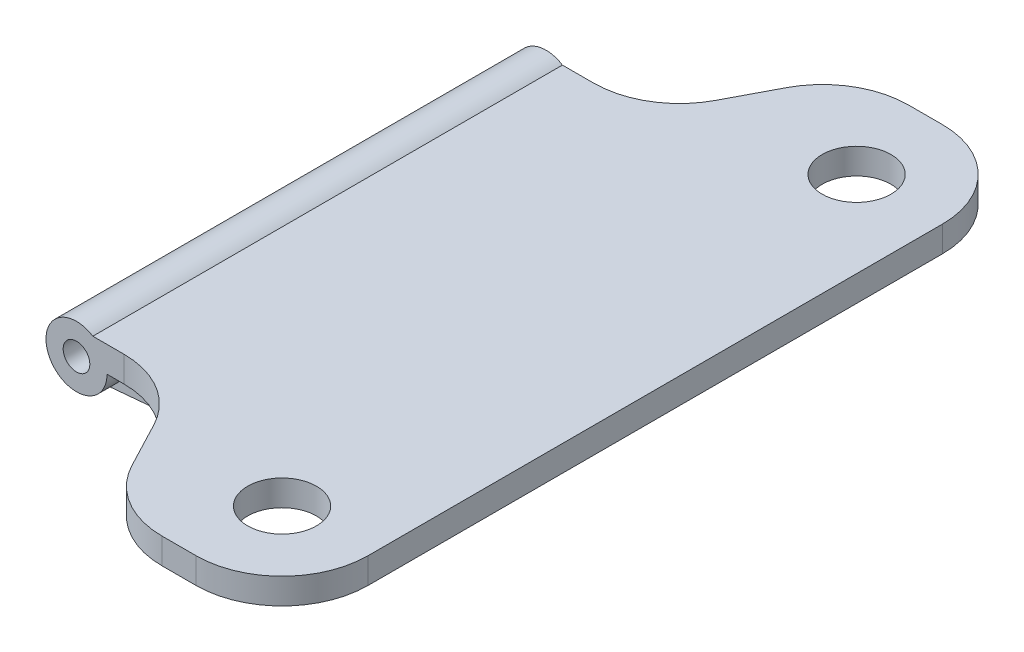
from build123d import *

# Parameters (mm, degrees)
MOUNT_CYLINDER_DEPTH      = 34.671
MOUNT_CYLINDER_DEPTH_BACK = 34.671
SKETCH1_R                 = 4.5085
SKETCH1_R_2               = 1.9685
SKETCH2_R                 = 5.08
BOSS_EXTRUDE1_DEPTH       = 3.81
BOSS_EXTRUDE3_DEPTH       = 31.75


with BuildPart() as part:
    # Sketch1 → Mount Cylinder (new, two sides: drawn at the far end of the back side and taken through both)
    with BuildSketch(Plane.XY.offset(-MOUNT_CYLINDER_DEPTH_BACK)):
        Circle(SKETCH1_R)
        Circle(SKETCH1_R_2, mode=Mode.SUBTRACT)
    extrude(amount=MOUNT_CYLINDER_DEPTH + MOUNT_CYLINDER_DEPTH_BACK)

    # Sketch2 → Boss-Extrude1 (add)
    with BuildSketch(Plane(origin=(0, 0, 0), x_dir=(1, 0, 0), z_dir=(0, 1, 0))):
        with BuildLine():
            Line((1.9685, -34.671), (6.991111132, -34.671))
            ThreePointArc((6.991111132, -34.671), (13.561283336, -36.502566939), (18.23638307, -41.468978393))
            Line((18.23638307, -41.468978393), (21.83211693, -48.320021607))
            ThreePointArc((21.83211693, -48.320021607), (26.507216664, -53.286433061), (33.077388868, -55.118))
            Line((33.077388868, -55.118), (38.1, -55.118))
            ThreePointArc((38.1, -55.118), (47.080256121, -51.398256121), (50.8, -42.418))
            Line((50.8, -42.418), (50.8, 42.418))
            ThreePointArc((50.8, 42.418), (47.080256121, 51.398256121), (38.1, 55.118))
            Line((38.1, 55.118), (33.077388868, 55.118))
            ThreePointArc((33.077388868, 55.118), (26.507216664, 53.286433061), (21.83211693, 48.320021607))
            Line((21.83211693, 48.320021607), (18.23638307, 41.468978393))
            ThreePointArc((18.23638307, 41.468978393), (13.561283336, 36.502566939), (6.991111132, 34.671))
            Line((6.991111132, 34.671), (1.9685, 34.671))
            Line((1.9685, 34.671), (1.9685, -34.671))
        make_face()
        with Locations((38.1, 42.418)):
            Circle(SKETCH2_R, mode=Mode.SUBTRACT)
        with Locations((38.1, -42.418)):
            Circle(SKETCH2_R, mode=Mode.SUBTRACT)
    extrude(amount=BOSS_EXTRUDE1_DEPTH)

    # Sketch3 → Boss-Extrude3 (add, symmetric)
    with BuildSketch(Plane.XY):
        Polygon((0, -4.5085), (0, -1.9685), (4.056054733, -1.9685), (4.056054733, 0), (50.8, 0), align=None)
    extrude(amount=BOSS_EXTRUDE3_DEPTH, both=True)


solid = part.part
